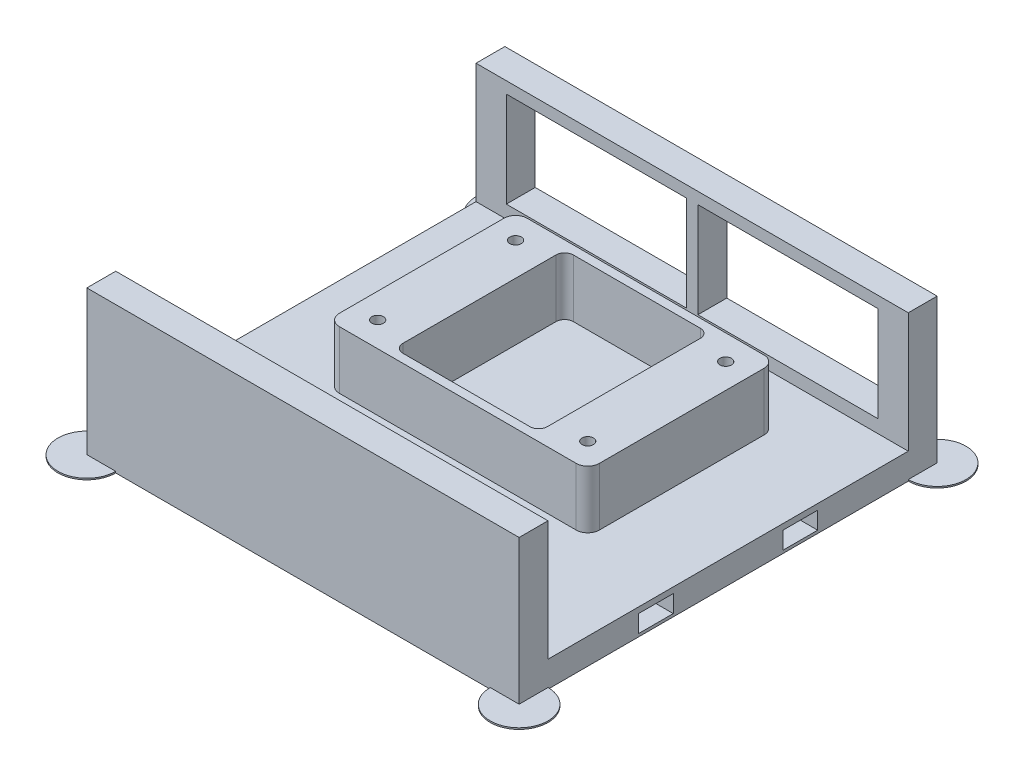
from build123d import *

# Parameters (mm, degrees)
BOSS_EXTRUDE1_DEPTH     = 8
SKETCH2_W               = 10.5
SKETCH2_H               = 10
BOSS_EXTRUDE2_DEPTH     = 37.5
SKETCH4_W               = 128.649180674
SKETCH4_H               = 10
BOSS_EXTRUDE4_DEPTH     = 4.5
BOSS_EXTRUDE5_DEPTH     = 10
SKETCH6_W               = 149.649180674
SKETCH6_H               = 10
BOSS_EXTRUDE6_DEPTH     = 4
CUT_EXTRUDE1_REACH      = 249.54
SKETCH7_R               = 2.5
MIRROR2_COPY_1_REACH    = 249.54
MIRROR2_COPY_1_SKETCH_R = 2.5
CUT_EXTRUDE2_REACH      = 314.548
SKETCH8_R               = 2.5
BOSS_EXTRUDE8_DEPTH     = 63
CUT_EXTRUDE3_REACH      = 257.708
SKETCH10_R              = 2.5
MIRROR5_COPY_1_REACH    = 257.708
MIRROR5_COPY_1_SKETCH_R = 2.5
CUT_EXTRUDE4_REACH      = 321.057
SKETCH11_R              = 2.5
SKETCH12_W              = 6.577848346
SKETCH12_H              = 46
BOSS_EXTRUDE9_DEPTH     = 12
BOSS_EXTRUDE10_DEPTH    = 20
SKETCH14_R              = 2
CUT_EXTRUDE5_DEPTH      = 10
SKETCH15_W              = 149.649180674
SKETCH15_H              = 10
BOSS_EXTRUDE11_DEPTH    = 41.5
SKETCH17_R              = 2
CUT_EXTRUDE6_DEPTH      = 10
ENL_V_START             = -2
ESQUISSE1_W             = 12
ESQUISSE1_H             = 42
ESQUISSE1_W_2           = 42
ESQUISSE1_H_2           = 12
ENL_V_MAT_EXTRU_1_DEPTH = 6
BOSS_EXTRU_1_DEPTH      = 1
CONG_1_R                = 5
ENL_V_MAT_EXTRU_2_DEPTH = 10
ESQUISSE5_W             = 52
ESQUISSE5_H             = 55
ENL_V_MAT_EXTRU_3_DEPTH = 10
ESQUISSE6_W             = 52
ESQUISSE6_H             = 55
ENL_V_MAT_EXTRU_4_DEPTH = 10
ESQUISSE7_W             = 52
ESQUISSE7_H             = 55
ENL_V_MAT_EXTRU_5_DEPTH = 10
ESQUISSE8_W             = 52
ESQUISSE8_H             = 55
ENL_V_MAT_EXTRU_6_DEPTH = 10
ESQUISSE9_W             = 52
ESQUISSE9_H             = 55
ENL_V_MAT_EXTRU_7_DEPTH = 10
BOSS_EXTRU_2_REACH      = 182.079
ESQUISSE11_W            = 4
ESQUISSE11_H            = 10
ENL_V_MAT_EXTRU_8_DEPTH = 186.634594874
ESQUISSE13_R            = 10
BOSS_EXTRU_3_DEPTH      = 0.5


with BuildPart() as part:
    # Sketch1 → Boss-Extrude1 (new body)
    with BuildSketch(Plane(origin=(0, 0, 0), x_dir=(1, 0, 0), z_dir=(0, 1, 0))):
        Polygon((-150, 45), (-150, -45), (-74.824590337, -72.361611466), (74.824590337, -72.361611466), (150, -45), (150, 45), (74.824590337, 72.361611466), (-74.824590337, 72.361611466), align=None)
    extrude(amount=BOSS_EXTRUDE1_DEPTH)

    # Sketch2 → Boss-Extrude2 (add)
    with BuildSketch(Plane(origin=(0, 8, 0), x_dir=(1, 0, 0), z_dir=(0, 1, 0))):
        with Locations((69.574590337, 67.361611466)):
            Rectangle(SKETCH2_W, SKETCH2_H)
        with Locations((-69.574590337, 67.361611466)):
            Rectangle(SKETCH2_W, SKETCH2_H)
    extrude(amount=BOSS_EXTRUDE2_DEPTH)

    # Sketch4 → Boss-Extrude4 (add)
    with BuildSketch(Plane(origin=(0, 8, 0), x_dir=(1, 0, 0), z_dir=(0, 1, 0))):
        with Locations((0, 67.361611466)):
            Rectangle(SKETCH4_W, SKETCH4_H)
    extrude(amount=BOSS_EXTRUDE4_DEPTH)

    # Sketch5 → Boss-Extrude5 (add)
    with BuildSketch(Plane(origin=(0, 8, 0), x_dir=(1, 0, 0), z_dir=(0, 1, 0))):
        Polygon((-74.824590337, 62.361611466), (-87.040594407, 57.915349603), (-140.603073792, 38.420201433), (-143.422151654, 37.394141003), (-143.422151654, -37.394141003), (-140.603073792, -38.420201433), (-87.040594407, -57.915349603), (-74.824590337, -62.361611466), (-74.824590337, -72.361611466), (-150, -45), (-150, 45), (-74.824590337, 72.361611466), align=None)
        Polygon((150, 45), (150, -45), (74.824590337, -72.361611466), (74.824590337, -62.361611466), (87.040594407, -57.915349603), (140.603073792, -38.420201433), (143.422151654, -37.394141003), (143.422151654, 37.394141003), (140.603073792, 38.420201433), (87.040594407, 57.915349603), (74.824590337, 62.361611466), (74.824590337, 72.361611466), align=None)
    extrude(amount=BOSS_EXTRUDE5_DEPTH)

    # Sketch6 → Boss-Extrude6 (add)
    with BuildSketch(Plane(origin=(0, 45.5, 0), x_dir=(1, 0, 0), z_dir=(0, 1, 0))):
        with Locations((0, 67.361611466)):
            Rectangle(SKETCH6_W, SKETCH6_H)
    extrude(amount=BOSS_EXTRUDE6_DEPTH)

    # Sketch7 → Cut-Extrude1 (cut, up to next)
    with BuildSketch(Plane(origin=(32.009387984, 0, -87.945070697), x_dir=(-0.9396926207859068, 0, -0.3420201433256732), z_dir=(0.3420201433256732, 0, -0.9396926207859068)), mode=Mode.PRIVATE) as cut_extrude1_sk1:
        with Locations((-113.852986668, 13)):
            Circle(SKETCH7_R)
    cut_extrude1_tool1 = extrude(cut_extrude1_sk1.sketch, amount=-CUT_EXTRUDE1_REACH, mode=Mode.PRIVATE) & part.part
    # Sketch7 → Cut-Extrude1 (cut, up to next)
    with BuildSketch(Plane(origin=(32.009387984, 0, -87.945070697), x_dir=(-0.9396926207859068, 0, -0.3420201433256732), z_dir=(0.3420201433256732, 0, -0.9396926207859068)), mode=Mode.PRIVATE) as cut_extrude1_sk2:
        with Locations((-57.272986668, 13)):
            Circle(SKETCH7_R)
    cut_extrude1_tool2 = extrude(cut_extrude1_sk2.sketch, amount=-CUT_EXTRUDE1_REACH, mode=Mode.PRIVATE) & part.part
    cut_extrude1_1 = cut_extrude1_tool1.solids().sort_by_distance((138.996199, 13, -49.005056))[0]
    add(cut_extrude1_1, mode=Mode.SUBTRACT)
    cut_extrude1_2 = cut_extrude1_tool2.solids().sort_by_distance((85.828391, 13, -68.356556))[0]
    add(cut_extrude1_2, mode=Mode.SUBTRACT)
    cut_extrude1 = cut_extrude1_1 + cut_extrude1_2  # Cut-Extrude1 as one shape, for the pattern or mirror that repeats it

    # Mirror1: Cut-Extrude1 across plane
    add(cut_extrude1.mirror(Plane(origin=(0, 0, 0), x_dir=(0, 0, 1), z_dir=(1, 0, 0))), mode=Mode.SUBTRACT)

    # Mirror2: Cut-Extrude1 across plane
    add(cut_extrude1.mirror(Plane(origin=(0, 0, 0), x_dir=(1, 0, 0), z_dir=(0, 0, -1))), mode=Mode.SUBTRACT)

    # Mirror2 copy 1 sketch → Mirror2 copy 1 (cut, up to next)
    with BuildSketch(Plane(origin=(-32.009387984, 0, 87.945070697), x_dir=(0.9396926207859068, 0, 0.3420201433256732), z_dir=(-0.3420201433256732, 0, 0.9396926207859068)), mode=Mode.PRIVATE) as mirror2_copy_1_sk1:
        with Locations((-113.852986668, 13)):
            Circle(MIRROR2_COPY_1_SKETCH_R)
    mirror2_copy_1_tool1 = extrude(mirror2_copy_1_sk1.sketch, amount=-MIRROR2_COPY_1_REACH, mode=Mode.PRIVATE) & part.part
    # Mirror2 copy 1 sketch → Mirror2 copy 1 (cut, up to next)
    with BuildSketch(Plane(origin=(-32.009387984, 0, 87.945070697), x_dir=(0.9396926207859068, 0, 0.3420201433256732), z_dir=(-0.3420201433256732, 0, 0.9396926207859068)), mode=Mode.PRIVATE) as mirror2_copy_1_sk2:
        with Locations((-57.272986668, 13)):
            Circle(MIRROR2_COPY_1_SKETCH_R)
    mirror2_copy_1_tool2 = extrude(mirror2_copy_1_sk2.sketch, amount=-MIRROR2_COPY_1_REACH, mode=Mode.PRIVATE) & part.part
    add(mirror2_copy_1_tool1.solids().sort_by_distance((-138.996199, 13, 49.005056))[0], mode=Mode.SUBTRACT)
    add(mirror2_copy_1_tool2.solids().sort_by_distance((-85.828391, 13, 68.356556))[0], mode=Mode.SUBTRACT)

    # Sketch8 → Cut-Extrude2 (cut, up to next)
    with BuildSketch(Plane(origin=(150, 0, 0), x_dir=(0, 0, -1), z_dir=(1, 0, 0)), mode=Mode.PRIVATE) as cut_extrude2_sk1:
        with Locations((-28.29, 13)):
            Circle(SKETCH8_R)
    cut_extrude2_tool1 = extrude(cut_extrude2_sk1.sketch, amount=-CUT_EXTRUDE2_REACH, mode=Mode.PRIVATE) & part.part
    # Sketch8 → Cut-Extrude2 (cut, up to next)
    with BuildSketch(Plane(origin=(150, 0, 0), x_dir=(0, 0, -1), z_dir=(1, 0, 0)), mode=Mode.PRIVATE) as cut_extrude2_sk2:
        with Locations((28.29, 13)):
            Circle(SKETCH8_R)
    cut_extrude2_tool2 = extrude(cut_extrude2_sk2.sketch, amount=-CUT_EXTRUDE2_REACH, mode=Mode.PRIVATE) & part.part
    cut_extrude2_1 = cut_extrude2_tool1.solids().sort_by_distance((150, 13, 28.29))[0]
    add(cut_extrude2_1, mode=Mode.SUBTRACT)
    cut_extrude2_2 = cut_extrude2_tool2.solids().sort_by_distance((150, 13, -28.29))[0]
    add(cut_extrude2_2, mode=Mode.SUBTRACT)
    cut_extrude2 = cut_extrude2_1 + cut_extrude2_2  # Cut-Extrude2 as one shape, for the pattern or mirror that repeats it

    # Mirror3: Cut-Extrude2 across plane
    add(cut_extrude2.mirror(Plane(origin=(0, 0, 0), x_dir=(0, 0, 1), z_dir=(1, 0, 0))), mode=Mode.SUBTRACT)

    # Sketch9 → Boss-Extrude8 (add)
    with BuildSketch(Plane(origin=(0, 18, 0), x_dir=(1, 0, 0), z_dir=(0, 1, 0))):
        Polygon((143.422151654, 23), (150, 23), (150, 45), (134.025225447, 50.814342437), (130.811287398, 41.984120221), (143.422151654, 37.394141003), align=None)
        Polygon((74.824590337, 72.361611466), (90.79936489, 66.54726903), (87.585426842, 57.717046814), (74.824590337, 62.361611466), align=None)
        Polygon((-74.824590337, 62.361611466), (-74.824590337, 72.361611466), (-90.79936489, 66.54726903), (-87.585426842, 57.717046814), align=None)
        Polygon((-143.422151654, 37.394141003), (-143.422151654, 23), (-150, 23), (-150, 45), (-134.025225447, 50.814342437), (-130.811287398, 41.984120221), align=None)
        Polygon((143.422151654, -37.394141003), (143.422151654, -23), (150, -23), (150, -45), (134.025225447, -50.814342437), (130.811287398, -41.984120221), align=None)
        Polygon((-143.422151654, -23), (-150, -23), (-150, -45), (-134.025225447, -50.814342437), (-130.811287398, -41.984120221), (-143.422151654, -37.394141003), align=None)
        Polygon((-74.824590337, -72.361611466), (-90.79936489, -66.54726903), (-87.585426842, -57.717046814), (-74.824590337, -62.361611466), align=None)
        Polygon((74.824590337, -62.361611466), (74.824590337, -72.361611466), (90.79936489, -66.54726903), (87.585426842, -57.717046814), align=None)
    extrude(amount=BOSS_EXTRUDE8_DEPTH)

    # Sketch10 → Cut-Extrude3 (cut, up to next)
    with BuildSketch(Plane(origin=(32.009387984, 0, -87.945070697), x_dir=(-0.9396926207859068, 0, -0.3420201433256732), z_dir=(0.3420201433256732, 0, -0.9396926207859068)), mode=Mode.PRIVATE) as cut_extrude3_sk1:
        with Locations((-113.852986668, 74)):
            Circle(SKETCH10_R)
    cut_extrude3_tool1 = extrude(cut_extrude3_sk1.sketch, amount=-CUT_EXTRUDE3_REACH, mode=Mode.PRIVATE) & part.part
    # Sketch10 → Cut-Extrude3 (cut, up to next)
    with BuildSketch(Plane(origin=(32.009387984, 0, -87.945070697), x_dir=(-0.9396926207859068, 0, -0.3420201433256732), z_dir=(0.3420201433256732, 0, -0.9396926207859068)), mode=Mode.PRIVATE) as cut_extrude3_sk2:
        with Locations((-57.272986668, 74)):
            Circle(SKETCH10_R)
    cut_extrude3_tool2 = extrude(cut_extrude3_sk2.sketch, amount=-CUT_EXTRUDE3_REACH, mode=Mode.PRIVATE) & part.part
    cut_extrude3_1 = cut_extrude3_tool1.solids().sort_by_distance((138.996199, 74, -49.005056))[0]
    add(cut_extrude3_1, mode=Mode.SUBTRACT)
    cut_extrude3_2 = cut_extrude3_tool2.solids().sort_by_distance((85.828391, 74, -68.356556))[0]
    add(cut_extrude3_2, mode=Mode.SUBTRACT)
    cut_extrude3 = cut_extrude3_1 + cut_extrude3_2  # Cut-Extrude3 as one shape, for the pattern or mirror that repeats it

    # Mirror4: Cut-Extrude3 across plane
    add(cut_extrude3.mirror(Plane(origin=(0, 0, 0), x_dir=(0, 0, 1), z_dir=(1, 0, 0))), mode=Mode.SUBTRACT)

    # Mirror5: Cut-Extrude3 across plane
    add(cut_extrude3.mirror(Plane(origin=(0, 0, 0), x_dir=(1, 0, 0), z_dir=(0, 0, -1))), mode=Mode.SUBTRACT)

    # Mirror5 copy 1 sketch → Mirror5 copy 1 (cut, up to next)
    with BuildSketch(Plane(origin=(-32.009387984, 0, 87.945070697), x_dir=(0.9396926207859068, 0, 0.3420201433256732), z_dir=(-0.3420201433256732, 0, 0.9396926207859068)), mode=Mode.PRIVATE) as mirror5_copy_1_sk1:
        with Locations((-113.852986668, 74)):
            Circle(MIRROR5_COPY_1_SKETCH_R)
    mirror5_copy_1_tool1 = extrude(mirror5_copy_1_sk1.sketch, amount=-MIRROR5_COPY_1_REACH, mode=Mode.PRIVATE) & part.part
    # Mirror5 copy 1 sketch → Mirror5 copy 1 (cut, up to next)
    with BuildSketch(Plane(origin=(-32.009387984, 0, 87.945070697), x_dir=(0.9396926207859068, 0, 0.3420201433256732), z_dir=(-0.3420201433256732, 0, 0.9396926207859068)), mode=Mode.PRIVATE) as mirror5_copy_1_sk2:
        with Locations((-57.272986668, 74)):
            Circle(MIRROR5_COPY_1_SKETCH_R)
    mirror5_copy_1_tool2 = extrude(mirror5_copy_1_sk2.sketch, amount=-MIRROR5_COPY_1_REACH, mode=Mode.PRIVATE) & part.part
    add(mirror5_copy_1_tool1.solids().sort_by_distance((-138.996199, 74, 49.005056))[0], mode=Mode.SUBTRACT)
    add(mirror5_copy_1_tool2.solids().sort_by_distance((-85.828391, 74, 68.356556))[0], mode=Mode.SUBTRACT)

    # Sketch11 → Cut-Extrude4 (cut, up to next)
    with BuildSketch(Plane(origin=(150, 0, 0), x_dir=(0, 0, -1), z_dir=(1, 0, 0)), mode=Mode.PRIVATE) as cut_extrude4_sk1:
        with Locations((-28.29, 74)):
            Circle(SKETCH11_R)
    cut_extrude4_tool1 = extrude(cut_extrude4_sk1.sketch, amount=-CUT_EXTRUDE4_REACH, mode=Mode.PRIVATE) & part.part
    # Sketch11 → Cut-Extrude4 (cut, up to next)
    with BuildSketch(Plane(origin=(150, 0, 0), x_dir=(0, 0, -1), z_dir=(1, 0, 0)), mode=Mode.PRIVATE) as cut_extrude4_sk2:
        with Locations((28.29, 74)):
            Circle(SKETCH11_R)
    cut_extrude4_tool2 = extrude(cut_extrude4_sk2.sketch, amount=-CUT_EXTRUDE4_REACH, mode=Mode.PRIVATE) & part.part
    cut_extrude4_1 = cut_extrude4_tool1.solids().sort_by_distance((150, 74, 28.29))[0]
    add(cut_extrude4_1, mode=Mode.SUBTRACT)
    cut_extrude4_2 = cut_extrude4_tool2.solids().sort_by_distance((150, 74, -28.29))[0]
    add(cut_extrude4_2, mode=Mode.SUBTRACT)
    cut_extrude4 = cut_extrude4_1 + cut_extrude4_2  # Cut-Extrude4 as one shape, for the pattern or mirror that repeats it

    # Mirror6: Cut-Extrude4 across plane
    add(cut_extrude4.mirror(Plane(origin=(0, 0, 0), x_dir=(0, 0, 1), z_dir=(1, 0, 0))), mode=Mode.SUBTRACT)

    # Sketch12 → Boss-Extrude9 (add)
    with BuildSketch(Plane(origin=(0, 81, 0), x_dir=(1, 0, 0), z_dir=(0, 1, 0))):
        Polygon((130.811287398, 41.984120221), (87.585426842, 57.717046814), (90.79936489, 66.54726903), (134.025225447, 50.814342437), align=None)
        with Locations((146.711075827, 0)):
            Rectangle(SKETCH12_W, SKETCH12_H)
        Polygon((134.025225447, -50.814342437), (130.811287398, -41.984120221), (87.585426842, -57.717046814), (90.79936489, -66.54726903), align=None)
        Polygon((-130.811287398, -41.984120221), (-87.585426842, -57.717046814), (-90.79936489, -66.54726903), (-134.025225447, -50.814342437), align=None)
        with Locations((-146.711075827, 0)):
            Rectangle(SKETCH12_W, SKETCH12_H)
        Polygon((-134.025225447, 50.814342437), (-130.811287398, 41.984120221), (-87.585426842, 57.717046814), (-90.79936489, 66.54726903), align=None)
    extrude(amount=-BOSS_EXTRUDE9_DEPTH)

    # Sketch13 → Boss-Extrude10 (add)
    with BuildSketch(Plane(origin=(0, 8, 0), x_dir=(1, 0, 0), z_dir=(0, 1, 0))):
        with BuildLine():
            Line((-41, 46.231611466), (-29, 46.231611466))
            Line((-29, 46.231611466), (29, 46.231611466))
            Line((29, 46.231611466), (41, 46.231611466))
            ThreePointArc((41, 46.231611466), (43.828427125, 45.060038591), (45, 42.231611466))
            Line((45, 42.231611466), (45, -14.768388534))
            ThreePointArc((45, -14.768388534), (43.828427125, -17.596815659), (41, -18.768388534))
            Line((41, -18.768388534), (29, -18.768388534))
            Line((29, -18.768388534), (-29, -18.768388534))
            Line((-29, -18.768388534), (-41, -18.768388534))
            ThreePointArc((-41, -18.768388534), (-43.828427125, -17.596815659), (-45, -14.768388534))
            Line((-45, -14.768388534), (-45, 42.231611466))
            ThreePointArc((-45, 42.231611466), (-43.828427125, 45.060038591), (-41, 46.231611466))
        make_face()
        with BuildLine():
            Line((-25, 40.231611466), (-25, -12.768388534))
            ThreePointArc((-25, -12.768388534), (-24.121320344, -14.889708878), (-22, -15.768388534))
            Line((-22, -15.768388534), (22, -15.768388534))
            ThreePointArc((22, -15.768388534), (24.121320344, -14.889708878), (25, -12.768388534))
            Line((25, -12.768388534), (25, 40.231611466))
            ThreePointArc((25, 40.231611466), (24.121320344, 42.35293181), (22, 43.231611466))
            Line((22, 43.231611466), (-22, 43.231611466))
            ThreePointArc((-22, 43.231611466), (-24.121320344, 42.35293181), (-25, 40.231611466))
        make_face(mode=Mode.SUBTRACT)
    extrude(amount=BOSS_EXTRUDE10_DEPTH)

    # Sketch14 → Cut-Extrude5 (cut)
    with BuildSketch(Plane(origin=(0, 28, 0), x_dir=(1, 0, 0), z_dir=(0, 1, 0))):
        with Locations(Location((-36.37, 37.606611466, 0), (0, 0, 270))):
            Circle(SKETCH14_R)
        with Locations(Location((-36.37, -10.143388534, 0), (0, 0, 270))):
            Circle(SKETCH14_R)
    cut_extrude5 = extrude(amount=-CUT_EXTRUDE5_DEPTH, mode=Mode.SUBTRACT)

    # Mirror7: Cut-Extrude5 across plane
    add(cut_extrude5.mirror(Plane(origin=(0, 0, 0), x_dir=(0, 0, 1), z_dir=(1, 0, 0))), mode=Mode.SUBTRACT)

    # Sketch15 → Boss-Extrude11 (add)
    with BuildSketch(Plane(origin=(0, 8, 0), x_dir=(1, 0, 0), z_dir=(0, 1, 0))):
        with Locations((0, -67.361611466)):
            Rectangle(SKETCH15_W, SKETCH15_H)
    extrude(amount=BOSS_EXTRUDE11_DEPTH)

    # Sketch17 → Cut-Extrude6 (cut)
    with BuildSketch(Plane(origin=(0, 81, 0), x_dir=(1, 0, 0), z_dir=(0, 1, 0))):
        with Locations(Location((145.085087734, -41.558541382, 0), (0, 0, 270))):
            Circle(SKETCH17_R)
        with Locations(Location((145.085087734, 41.558541382, 0), (0, 0, 90))):
            Circle(SKETCH17_R)
        with Locations(Location((-145.085087734, 41.558541382, 0), (0, 0, 270))):
            Circle(SKETCH17_R)
        with Locations(Location((-145.085087734, -41.558541382, 0), (0, 0, 90))):
            Circle(SKETCH17_R)
    extrude(amount=-CUT_EXTRUDE6_DEPTH, mode=Mode.SUBTRACT)

    # Esquisse1 → Enlèv. mat.-Extru.1 (cut)
    with BuildSketch(Plane(origin=(0, 8, 0), x_dir=(1, 0, 0), z_dir=(0, 1, 0)).offset(ENL_V_START)):
        with Locations((-126, 0)):
            Rectangle(ESQUISSE1_W, ESQUISSE1_H)
        with Locations((126, 0)):
            Rectangle(ESQUISSE1_W, ESQUISSE1_H)
        with Locations((-74.824590337, 25)):
            Rectangle(ESQUISSE1_W_2, ESQUISSE1_H_2)
        with Locations((-74.824590337, -25)):
            Rectangle(ESQUISSE1_W_2, ESQUISSE1_H_2)
        with Locations((74.824590337, -25)):
            Rectangle(ESQUISSE1_W_2, ESQUISSE1_H_2)
        with Locations((74.824590337, 25)):
            Rectangle(ESQUISSE1_W_2, ESQUISSE1_H_2)
    extrude(amount=-ENL_V_MAT_EXTRU_1_DEPTH, mode=Mode.SUBTRACT)

    # Esquisse2 → Boss.-Extru.1 (add)
    with BuildSketch(Plane.XZ):
        Polygon((-150, -45), (-74.824590337, -72.361611466), (74.824590337, -72.361611466), (150, -45), (150, 45), (74.824590337, 72.361611466), (-74.824590337, 72.361611466), (-150, 45), align=None)
    extrude(amount=BOSS_EXTRU_1_DEPTH)

    # Congé1
    cong_1_edges = [part.edges().sort_by_distance(p)[0] for p in [
        (150, 40, -45),
        (150, 40, 45),
        (-150, 40, 45),
        (-150, 40, -45),
    ]]
    fillet(cong_1_edges, radius=CONG_1_R)

    # Esquisse3 → Enlèv. mat.-Extru.2 (cut)
    with BuildSketch(Plane(origin=(-32.009387984, 0, 87.945070697), x_dir=(0.9396926207859068, 0, 0.34202014332567315), z_dir=(-0.34202014332567315, 0, 0.9396926207859069))):
        with BuildLine():
            Line((-56.562986668, 69), (-62.562986668, 69))
            Line((-62.562986668, 69), (-62.562986668, 18))
            Line((-62.562986668, 18), (-108.562986668, 18))
            Line((-108.562986668, 18), (-108.562986668, 14))
            Line((-108.562986668, 14), (-59.564274516, 14))
            ThreePointArc((-59.564274516, 14), (-58.328004424, 15.266481312), (-56.562986668, 15.3970607))
            Line((-56.562986668, 15.3970607), (-56.562986668, 69))
        make_face()
    extrude(amount=-ENL_V_MAT_EXTRU_2_DEPTH, mode=Mode.SUBTRACT)

    # Esquisse5 → Enlèv. mat.-Extru.3 (cut)
    with BuildSketch(Plane.ZY.offset(150)):
        with Locations((3, 41.5)):
            Rectangle(ESQUISSE5_W, ESQUISSE5_H)
    extrude(amount=-ENL_V_MAT_EXTRU_3_DEPTH, mode=Mode.SUBTRACT)

    # Esquisse6 → Enlèv. mat.-Extru.4 (cut)
    with BuildSketch(Plane(origin=(-32.009387984, 0, -87.945070697), x_dir=(-0.9396926207859068, 0, 0.34202014332567315), z_dir=(-0.34202014332567315, 0, -0.9396926207859069))):
        with Locations((88.562986668, 41.5)):
            Rectangle(ESQUISSE6_W, ESQUISSE6_H)
    extrude(amount=-ENL_V_MAT_EXTRU_4_DEPTH, mode=Mode.SUBTRACT)

    # Esquisse7 → Enlèv. mat.-Extru.5 (cut)
    with BuildSketch(Plane(origin=(32.009387984, 0, -87.945070697), x_dir=(-0.9396926207859068, 0, -0.3420201433256732), z_dir=(0.3420201433256732, 0, -0.9396926207859068))):
        with Locations((-82.562986668, 41.5)):
            Rectangle(ESQUISSE7_W, ESQUISSE7_H)
    extrude(amount=-ENL_V_MAT_EXTRU_5_DEPTH, mode=Mode.SUBTRACT)

    # Esquisse8 → Enlèv. mat.-Extru.6 (cut)
    with BuildSketch(Plane(origin=(150, 0, 0), x_dir=(0, 0, -1), z_dir=(1, 0, 0))):
        with Locations((3, 41.5)):
            Rectangle(ESQUISSE8_W, ESQUISSE8_H)
    extrude(amount=-ENL_V_MAT_EXTRU_6_DEPTH, mode=Mode.SUBTRACT)

    # Esquisse9 → Enlèv. mat.-Extru.7 (cut)
    with BuildSketch(Plane(origin=(32.009387984, 0, 87.945070697), x_dir=(0.9396926207859068, 0, -0.3420201433256732), z_dir=(0.3420201433256732, 0, 0.9396926207859068))):
        with Locations((88.562986668, 41.5)):
            Rectangle(ESQUISSE9_W, ESQUISSE9_H)
    extrude(amount=-ENL_V_MAT_EXTRU_7_DEPTH, mode=Mode.SUBTRACT)

    # Esquisse11 → Boss.-Extru.2 (add, up to next)
    with BuildSketch(Plane(origin=(0, 12.5, 0), x_dir=(1, 0, 0), z_dir=(0, 1, 0)), mode=Mode.PRIVATE) as boss_extru_2_sk1:
        with Locations((0, 67.361611466)):
            Rectangle(ESQUISSE11_W, ESQUISSE11_H)
    boss_extru_2_tool1 = extrude(boss_extru_2_sk1.sketch, amount=BOSS_EXTRU_2_REACH, mode=Mode.PRIVATE) - part.part
    add(boss_extru_2_tool1.solids().sort_by_distance((0, 12.5, -67.361611))[0])

    # Esquisse12 → Enlèv. mat.-Extru.8 (cut, through all)
    with BuildSketch(Plane(origin=(0, 81, 0), x_dir=(1, 0, 0), z_dir=(0, 1, 0))):
        Polygon((74.824590337, -74.951231664), (74.824590337, 102.234539141), (-74.824590337, 102.234539141), (-74.824590337, -146.92644803), (-203.199413677, -126.057634384), (-188.022094661, 94.645879634), (-19.291679618, 194.685093665), (183.822221219, 119.309023034), (217.580951732, -44.120206721), (162.3923462, -136.492041207), (87.820241487, -136.492041207), align=None)
    extrude(amount=-ENL_V_MAT_EXTRU_8_DEPTH, mode=Mode.SUBTRACT)

    # Esquisse13 → Boss.-Extru.3 (add)
    with BuildSketch(Plane.XZ.offset(1)):
        with Locations((74.824590337, -72.361611466)):
            Circle(ESQUISSE13_R)
        with Locations((-74.824590337, -72.361611466)):
            Circle(ESQUISSE13_R)
        with Locations((-74.824590337, 72.361611466)):
            Circle(ESQUISSE13_R)
        with Locations((74.824590337, 72.361611466)):
            Circle(ESQUISSE13_R)
    extrude(amount=-BOSS_EXTRU_3_DEPTH)


solid = part.part
